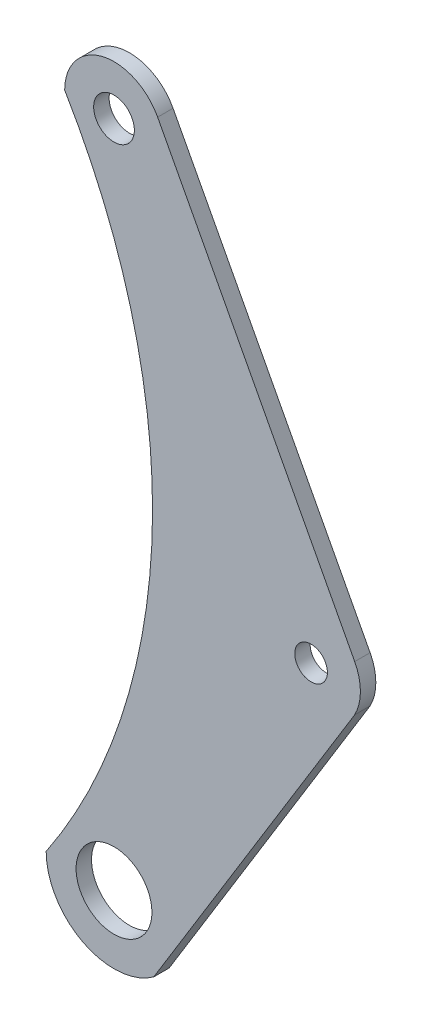
from build123d import *

# Parameters (mm, degrees)
SKETCH1_R           = 7.8105
SKETCH1_R_2         = 3.3655
SKETCH1_R_3         = 4.191
BOSS_EXTRUDE1_DEPTH = 3.175


with BuildPart() as part:
    # Sketch1 → Boss-Extrude1 (new body)
    with BuildSketch(Plane.XY):
        with BuildLine():
            Line((8.98309661, 142.414532976), (49.565953559, 65.609056962))
            ThreePointArc((49.565953559, 65.609056962), (50.742856949, 60.862523985), (49.565953559, 56.115991009))
            Line((49.565953559, 56.115991009), (8.177790267, -11.326281223))
            ThreePointArc((8.177790267, -11.326281223), (-6.360706327, -12.437938536), (-13.97, 0))
            ThreePointArc((-13.97, 0), (7.886144716, 68.281846548), (-10.16, 137.668))
            ThreePointArc((-10.16, 137.668), (-2.445131739, 147.529385845), (8.98309661, 142.414532976))
        make_face()
        Circle(SKETCH1_R, mode=Mode.SUBTRACT)
        with Locations((40.582856949, 60.862523985)):
            Circle(SKETCH1_R_2, mode=Mode.SUBTRACT)
        with Locations((0, 137.668)):
            Circle(SKETCH1_R_3, mode=Mode.SUBTRACT)
    extrude(amount=BOSS_EXTRUDE1_DEPTH)


solid = part.part
